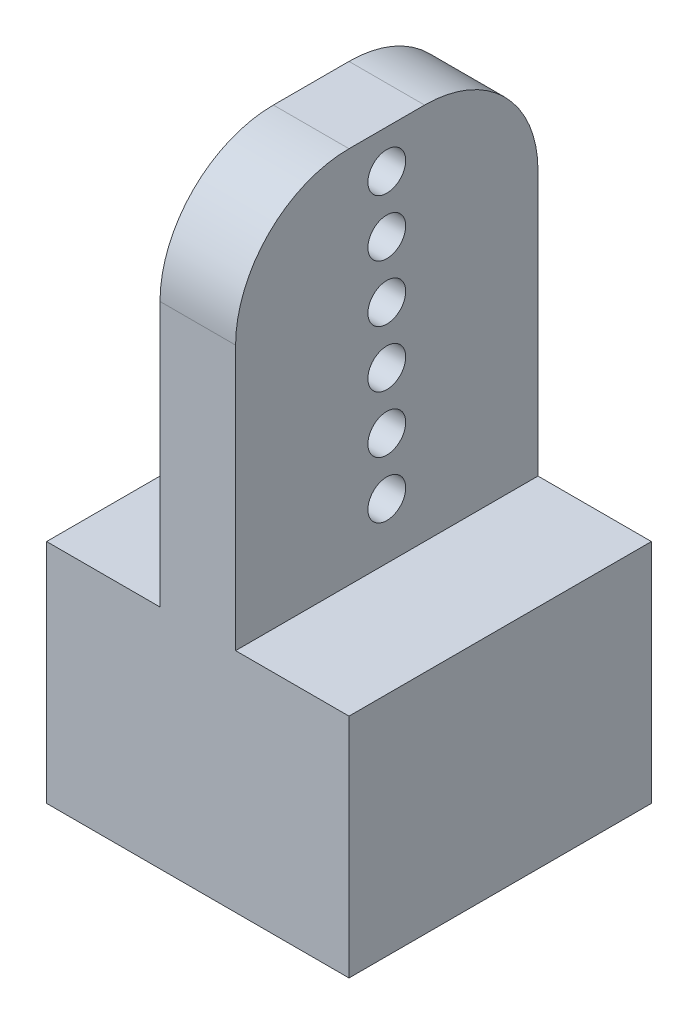
from build123d import *

# Parameters (mm, degrees)
SKETCH1_W           = 40
SKETCH1_H           = 40
SKETCH1_W_2         = 20
SKETCH1_H_2         = 20
BOSS_EXTRUDE1_DEPTH = 30
SKETCH4_W           = 10
SKETCH4_H           = 40
BOSS_EXTRUDE3_DEPTH = 50
SKETCH5_R           = 2.5
CUT_EXTRUDE4_DEPTH  = 87.168439698
LPATTERN1_COUNT     = 6
LPATTERN1_PITCH     = 7.5
FILLET1_R           = 15
SKETCH6_W           = 30
SKETCH6_H           = 22
CUT_EXTRUDE5_DEPTH  = 30
CUT_EXTRUDE6_REACH  = 86.853
SKETCH7_R           = 2.75


with BuildPart() as part:
    # Sketch1 → Boss-Extrude1 (new body)
    # profile 1 of 2: a face of its own
    with BuildSketch(Plane(origin=(0, 0, 0), x_dir=(1, 0, 0), z_dir=(0, 1, 0))):
        Rectangle(SKETCH1_W, SKETCH1_H)
        Rectangle(SKETCH1_W_2, SKETCH1_H_2, mode=Mode.SUBTRACT)
    # profile 2 of 2: a face of its own
    with BuildSketch(Plane(origin=(0, 0, 0), x_dir=(1, 0, 0), z_dir=(0, 1, 0))):
        Rectangle(SKETCH1_W_2, SKETCH1_H_2)
    extrude(amount=BOSS_EXTRUDE1_DEPTH)

    # Sketch4 → Boss-Extrude3 (add)
    with BuildSketch(Plane(origin=(0, 30, 0), x_dir=(1, 0, 0), z_dir=(0, 1, 0))):
        Rectangle(SKETCH4_W, SKETCH4_H)
    extrude(amount=BOSS_EXTRUDE3_DEPTH)

    # Sketch5 → Cut-Extrude4 (cut, through all)
    with BuildSketch(Plane(origin=(5, 0, 0), x_dir=(0, 0, -1), z_dir=(1, 0, 0))):
        with Locations((0, 37.407153601)):
            Circle(SKETCH5_R)
    cut_extrude4 = extrude(amount=-CUT_EXTRUDE4_DEPTH, mode=Mode.SUBTRACT)

    # LPattern1: Cut-Extrude4 ×6
    with Locations(*[(0, i * LPATTERN1_PITCH, 0) for i in range(1, LPATTERN1_COUNT)]):
        add(cut_extrude4, mode=Mode.SUBTRACT)

    # Fillet1
    fillet1_edges = [part.edges().sort_by_distance(p)[0] for p in [
        (0, 80, -20),
        (0, 80, 20),
    ]]
    fillet(fillet1_edges, radius=FILLET1_R)

    # Sketch6 → Cut-Extrude5 (cut)
    with BuildSketch(Plane(origin=(0, 0, -20), x_dir=(-1, 0, 0), z_dir=(0, 0, -1))):
        with Locations((0, 15)):
            Rectangle(SKETCH6_W, SKETCH6_H)
    extrude(amount=-CUT_EXTRUDE5_DEPTH, mode=Mode.SUBTRACT)

    # Sketch7 → Cut-Extrude6 (cut, up to next)
    with BuildSketch(Plane.XZ, mode=Mode.PRIVATE) as cut_extrude6_sk1:
        with Locations(Location((-7.5, -2, 0), (0, 0, 270))):
            Circle(SKETCH7_R)
    cut_extrude6_tool1 = extrude(cut_extrude6_sk1.sketch, amount=-CUT_EXTRUDE6_REACH, mode=Mode.PRIVATE) & part.part
    # Sketch7 → Cut-Extrude6 (cut, up to next)
    with BuildSketch(Plane.XZ, mode=Mode.PRIVATE) as cut_extrude6_sk2:
        with Locations(Location((7.5, -2, 0), (0, 0, 270))):
            Circle(SKETCH7_R)
    cut_extrude6_tool2 = extrude(cut_extrude6_sk2.sketch, amount=-CUT_EXTRUDE6_REACH, mode=Mode.PRIVATE) & part.part
    add(cut_extrude6_tool1.solids().sort_by_distance((-7.5, 0, -2))[0], mode=Mode.SUBTRACT)
    add(cut_extrude6_tool2.solids().sort_by_distance((7.5, 0, -2))[0], mode=Mode.SUBTRACT)


solid = part.part
